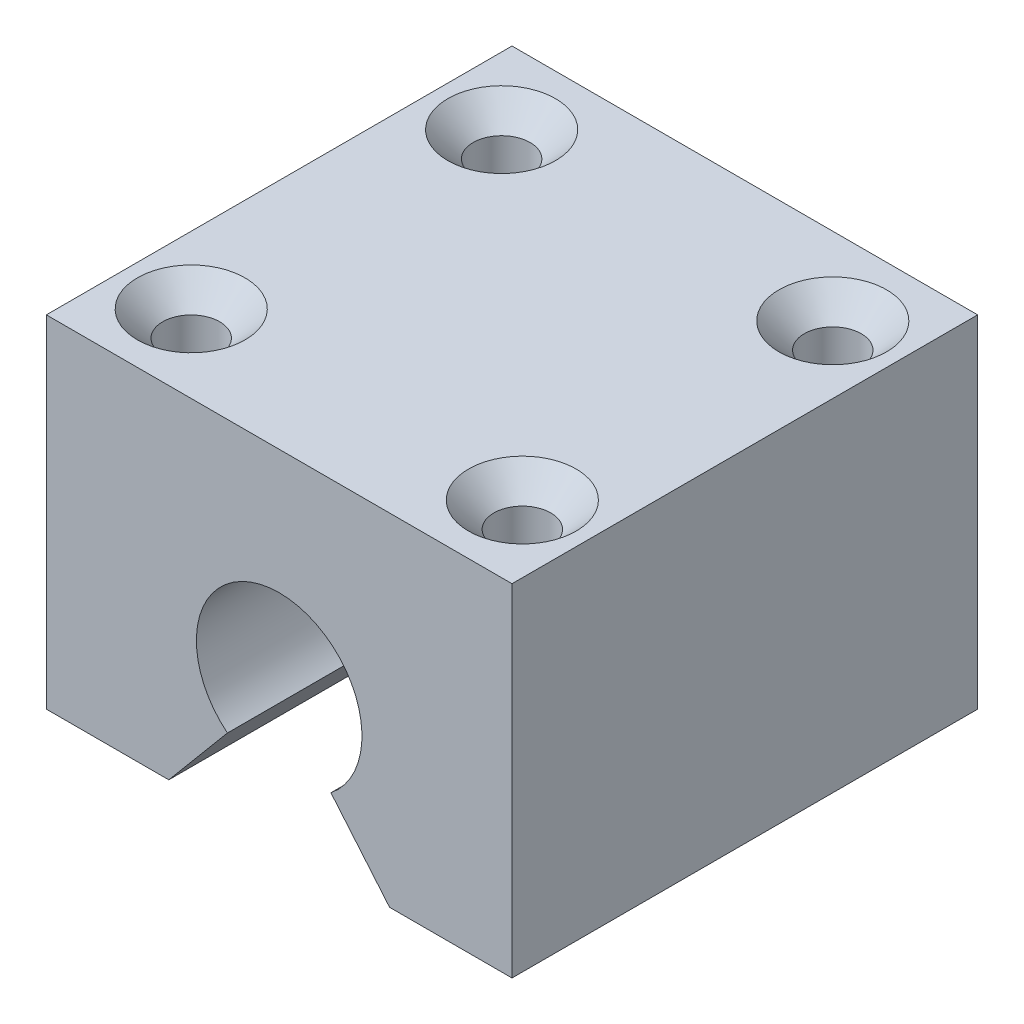
from build123d import *

# Parameters (mm, degrees)
SKETCH1_W                                            = 45
SKETCH1_H                                            = 33
BOSS_EXTRUDE1_DEPTH                                  = 45
CUT_EXTRUDE1_DEPTH                                   = 45
CSK_FOR_M5_COUNTERSUNK_RAISED_HEAD_SCREW_D           = 5.5
CSK_FOR_M5_COUNTERSUNK_RAISED_HEAD_SCREW_DEPTH       = 12
CSK_FOR_M5_COUNTERSUNK_RAISED_HEAD_SCREW_CSINK_D     = 10.4
CSK_FOR_M5_COUNTERSUNK_RAISED_HEAD_SCREW_CSINK_ANGLE = 90
CSK_FOR_M5_COUNTERSUNK_RAISED_HEAD_SCREW_TIP         = 1.652366702


with BuildPart() as part:
    # Sketch1 → Boss-Extrude1 (new body)
    with BuildSketch(Plane.XY):
        Rectangle(SKETCH1_W, SKETCH1_H)
    extrude(amount=BOSS_EXTRUDE1_DEPTH)

    # Sketch2 → Cut-Extrude1 (cut)
    with BuildSketch(Plane.XY.offset(45)):
        with BuildLine():
            Line((-5, -9.744997998), (-10.668119688, -16.5))
            Line((-10.668119688, -16.5), (10.668119688, -16.5))
            Line((10.668119688, -16.5), (5, -9.744997998))
            ThreePointArc((5, -9.744997998), (0, 4.5), (-5, -9.744997998))
        make_face()
    extrude(amount=-CUT_EXTRUDE1_DEPTH, mode=Mode.SUBTRACT)

    # CSK for M5 Countersunk Raised Head Screw1
    with Locations(Plane(origin=(0, 16.5, 0), x_dir=(1, 0, 0), z_dir=(0, 1, 0))):
        with Locations((-16, -37.5), (-16, -7.5), (16, -7.5), (16, -37.5)):
            CounterSinkHole(CSK_FOR_M5_COUNTERSUNK_RAISED_HEAD_SCREW_D / 2, CSK_FOR_M5_COUNTERSUNK_RAISED_HEAD_SCREW_CSINK_D / 2, depth=CSK_FOR_M5_COUNTERSUNK_RAISED_HEAD_SCREW_DEPTH, counter_sink_angle=CSK_FOR_M5_COUNTERSUNK_RAISED_HEAD_SCREW_CSINK_ANGLE)
            with Locations((0, 0, -(CSK_FOR_M5_COUNTERSUNK_RAISED_HEAD_SCREW_DEPTH + CSK_FOR_M5_COUNTERSUNK_RAISED_HEAD_SCREW_TIP / 2))):  # 118° drill point
                Cone(0, CSK_FOR_M5_COUNTERSUNK_RAISED_HEAD_SCREW_D / 2, CSK_FOR_M5_COUNTERSUNK_RAISED_HEAD_SCREW_TIP, mode=Mode.SUBTRACT)


solid = part.part
